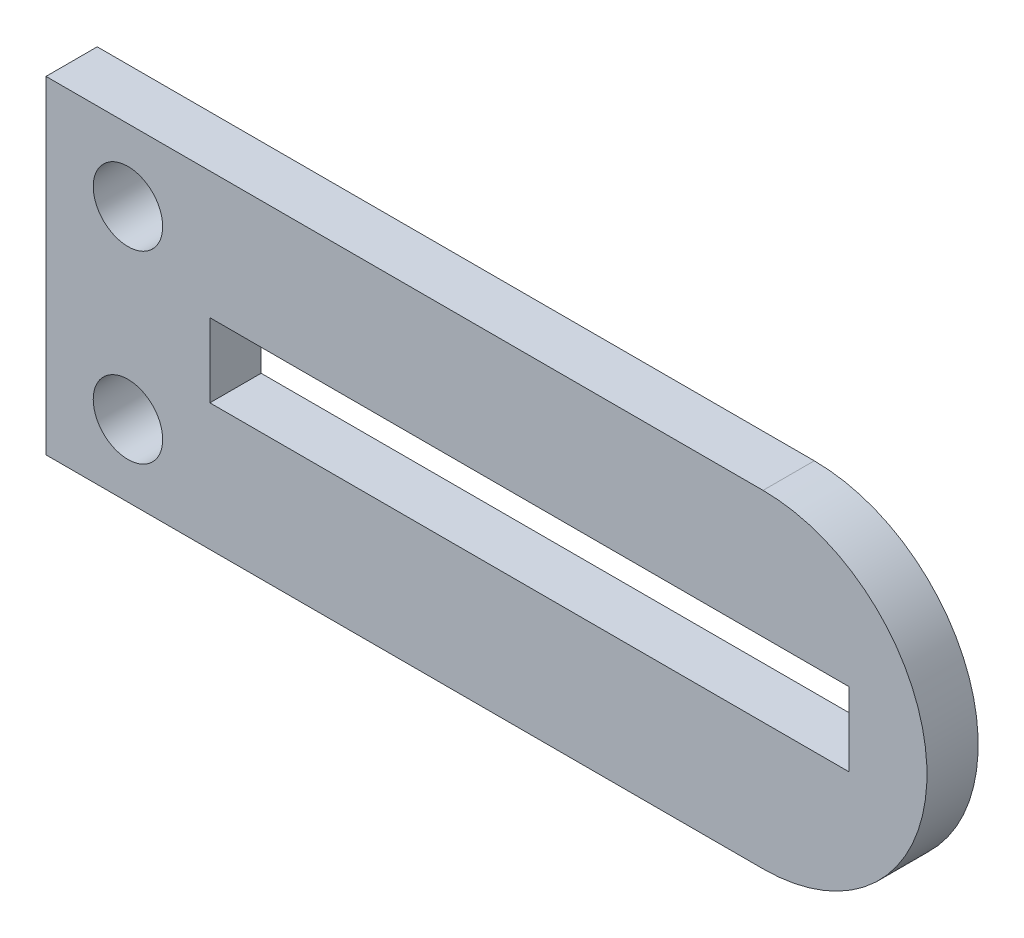
from build123d import *

# Parameters (mm, degrees)
SKETCH1_R           = 2.15265
SKETCH1_W           = 39.624
SKETCH1_H           = 4.572
BOSS_EXTRUDE1_DEPTH = 3.175


with BuildPart() as part:
    # Sketch1 → Boss-Extrude1 (new body)
    with BuildSketch(Plane.XY):
        with BuildLine():
            Line((0, 0), (0, 20.32))
            Line((0, 20.32), (44.45, 20.32))
            ThreePointArc((44.45, 20.32), (54.61, 10.16), (44.45, 0))
            Line((44.45, 0), (0, 0))
        make_face()
        with Locations((5.08, 15.875)):
            Circle(SKETCH1_R, mode=Mode.SUBTRACT)
        with Locations(Location((5.08, 4.445, 0), (0, 0, 180))):
            Circle(SKETCH1_R, mode=Mode.SUBTRACT)
        with Locations((29.972, 10.16)):
            Rectangle(SKETCH1_W, SKETCH1_H, mode=Mode.SUBTRACT)
    extrude(amount=BOSS_EXTRUDE1_DEPTH)


solid = part.part
